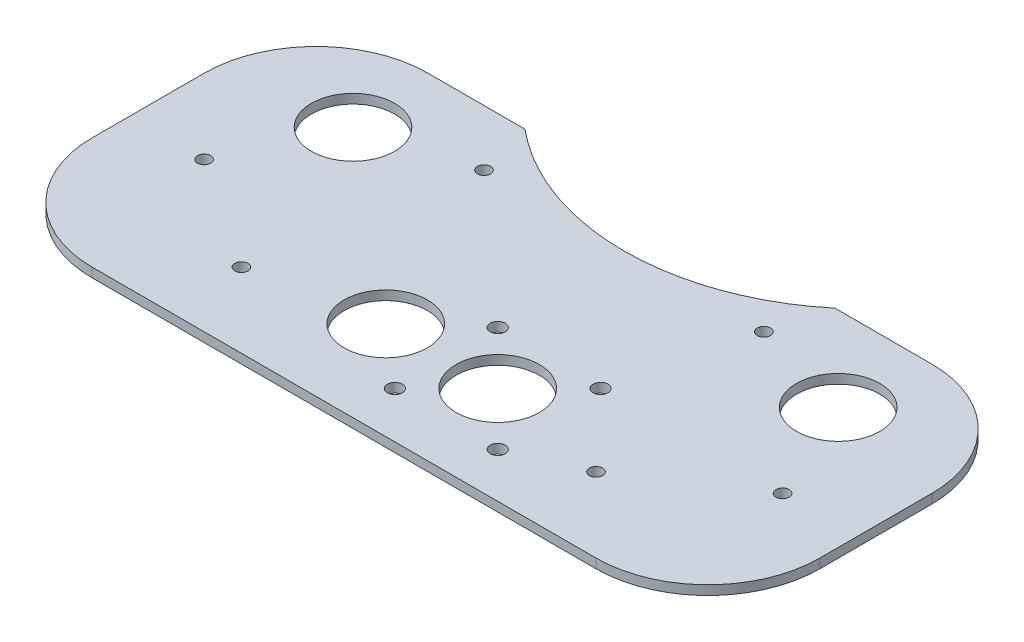
from build123d import *

# Parameters (mm, degrees)
BOSS_EXTRUDE1_DEPTH     = 3.175
F_1_1_115_DOWEL_HOLE1_D = 28.321
F_10_CLEARANCE_HOLE1_D  = 5.1054
FILLET1_R               = 38.1
F_1_1_115_DOWEL_HOLE2_D = 28.321
F_8_CLEARANCE_HOLE_D    = 4.4958
F_1_1_115_DOWEL_HOLE3_D = 28.321


with BuildPart() as part:
    # Sketch1 → Boss-Extrude1 (new body)
    with BuildSketch(Plane(origin=(0, 0, 0), x_dir=(1, 0, 0), z_dir=(0, 1, 0))):
        with BuildLine():
            Line((-123.825, -57.15), (123.825, -57.15))
            Line((123.825, -57.15), (123.825, 57.15))
            Line((123.825, 57.15), (52.74706153, 57.15))
            ThreePointArc((52.74706153, 57.15), (0, 38.1), (-52.74706153, 57.15))
            Line((-52.74706153, 57.15), (-123.825, 57.15))
            Line((-123.825, 57.15), (-123.825, -57.15))
        make_face()
    extrude(amount=BOSS_EXTRUDE1_DEPTH)

    # 1 (1.115) Dowel Hole1 (through all)
    with Locations(Plane(origin=(0, 3.175, 0), x_dir=(1, 0, 0), z_dir=(0, 1, 0))):
        with Locations((19.05, -23.906942448)):
            Hole(F_1_1_115_DOWEL_HOLE1_D / 2)

    # #10 Clearance Hole1 (through all)
    with Locations(Plane(origin=(0, 3.175, 0), x_dir=(1, 0, 0), z_dir=(0, 1, 0))):
        with Locations((1.55, -41.406942448), (36.55, -6.406942448), (1.089487758, -5.946430205), (37.010512242, -41.86745469)):
            Hole(F_10_CLEARANCE_HOLE1_D / 2)

    # Fillet1
    fillet1_edges = [part.edges().sort_by_distance(p)[0] for p in [
        (-123.825, 1.5875, -57.15),
        (-123.825, 1.5875, 57.15),
        (123.825, 1.5875, 57.15),
        (123.825, 1.5875, -57.15),
    ]]
    fillet(fillet1_edges, radius=FILLET1_R)

    # 1 (1.115) Dowel Hole2 (through all)
    with Locations(Plane(origin=(0, -34.925, 0), x_dir=(-1, 0, 0), z_dir=(0, -1, 0))):
        with Locations((82.55, 28.448), (-82.55, 28.448)):
            Hole(F_1_1_115_DOWEL_HOLE2_D / 2)

    # #8 Clearance Hole (through all)
    with Locations(Plane(origin=(0, 3.175, 0), x_dir=(1, 0, 0), z_dir=(0, 1, 0))):
        with Locations((-98.425, -6.35), (-60.325, -31.75), (-47.625, 38.1), (47.625, 38.1), (60.325, -31.75), (98.425, -6.35)):
            Hole(F_8_CLEARANCE_HOLE_D / 2)

    # 1 (1.115) Dowel Hole3 (through all)
    with Locations(Plane(origin=(0, -34.925, 0), x_dir=(-1, 0, 0), z_dir=(0, -1, 0))):
        with Locations((19.05, -23.906942448)):
            Hole(F_1_1_115_DOWEL_HOLE3_D / 2)


solid = part.part
